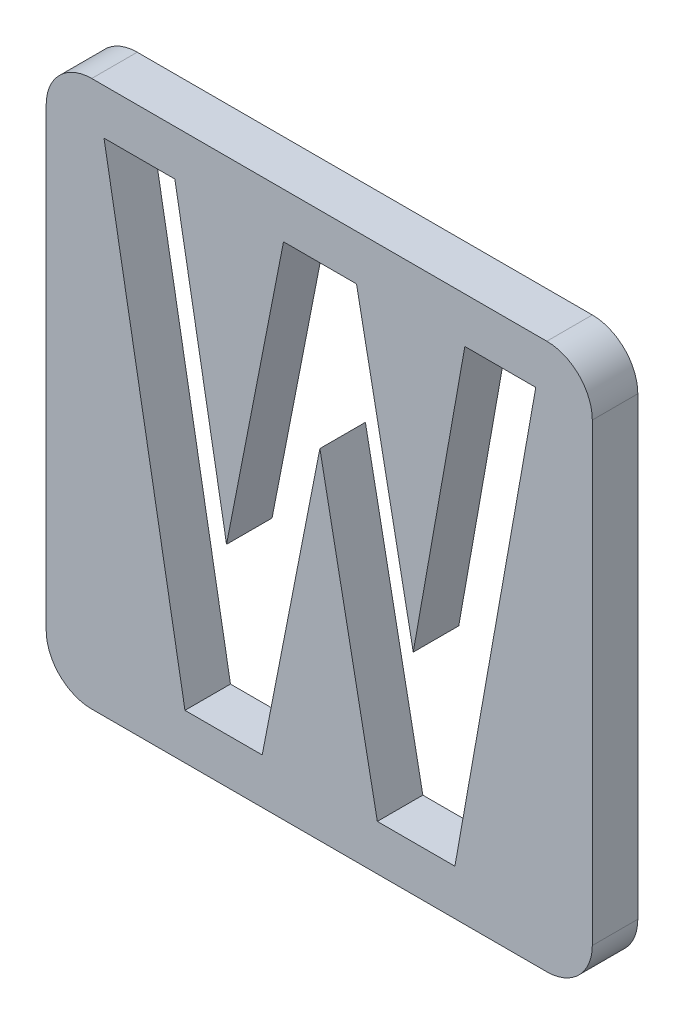
from build123d import *

# Parameters (mm, degrees)
BOSS_EXTRUDE1_DEPTH = 10
CUT_EXTRUDE36_DEPTH = 10


with BuildPart() as part:
    # Sketch1 → Boss-Extrude1 (new body)
    with BuildSketch(Plane.XY):
        with BuildLine():
            Line((-50, 60), (50, 60))
            ThreePointArc((50, 60), (57.071067812, 57.071067812), (60, 50))
            Line((60, 50), (60, -50))
            ThreePointArc((60, -50), (57.071067812, -57.071067812), (50, -60))
            Line((50, -60), (-50, -60))
            ThreePointArc((-50, -60), (-57.071067812, -57.071067812), (-60, -50))
            Line((-60, -50), (-60, 50))
            ThreePointArc((-60, 50), (-57.071067812, 57.071067812), (-50, 60))
        make_face()
    extrude(amount=BOSS_EXTRUDE1_DEPTH)

    # Sketch2 → Cut-Extrude36 (cut)
    with BuildSketch(Plane.XY.offset(10)):
        Polygon((-47.294871795, 50), (-31.729967949, 50), (-20.371794872, -13.842147436), (-7.851762821, 50), (8.193910256, 50), (20.653846154, -13.842147436), (31.991987179, 50), (47.576923077, 50), (29.80849359, -50), (12.761217949, -50), (0.141025641, 14.643429487), (-12.539262821, -50), (-29.506410256, -50), align=None)
    extrude(amount=-CUT_EXTRUDE36_DEPTH, mode=Mode.SUBTRACT)


solid = part.part
